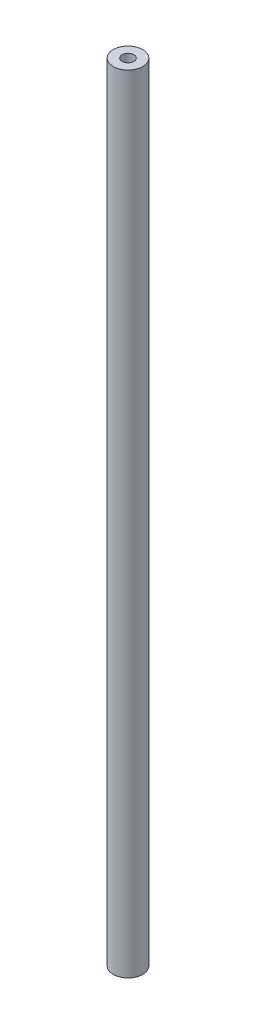
from build123d import *

# Parameters (mm, degrees)
SKETCH1_R                            = 4.7625
BOSS_EXTRUDE1_DEPTH                  = 254
F_10_24_TAPPED_HOLE1_D               = 3.7973
F_10_24_TAPPED_HOLE1_DEPTH           = 12.83
F_10_24_TAPPED_HOLE1_TIP             = 1.140824014
F_10_24_TAPPED_HOLE1_ON_FACE_2_D     = 3.7973
F_10_24_TAPPED_HOLE1_ON_FACE_2_DEPTH = 12.83
F_10_24_TAPPED_HOLE1_ON_FACE_2_TIP   = 1.140824014


with BuildPart() as part:
    # Sketch1 → Boss-Extrude1 (new body)
    with BuildSketch(Plane(origin=(0, 0, 0), x_dir=(1, 0, 0), z_dir=(0, 1, 0))):
        with Locations(Location((0, 0, 0), (0, 0, 270))):
            Circle(SKETCH1_R)
    extrude(amount=BOSS_EXTRUDE1_DEPTH)

    # #10-24 Tapped Hole1
    with Locations(Plane.ZX.offset(254)):
        with Locations((0, 0)):
            Hole(F_10_24_TAPPED_HOLE1_D / 2, depth=F_10_24_TAPPED_HOLE1_DEPTH)
            with Locations((0, 0, -(F_10_24_TAPPED_HOLE1_DEPTH + F_10_24_TAPPED_HOLE1_TIP / 2))):  # 118° drill point
                Cone(0, F_10_24_TAPPED_HOLE1_D / 2, F_10_24_TAPPED_HOLE1_TIP, mode=Mode.SUBTRACT)

    # #10-24 Tapped Hole1 on face 2
    with Locations(Plane(origin=(0, 0, 0), x_dir=(0, 0, -1), z_dir=(0, -1, 0))):
        with Locations((0, 0)):
            Hole(F_10_24_TAPPED_HOLE1_ON_FACE_2_D / 2, depth=F_10_24_TAPPED_HOLE1_ON_FACE_2_DEPTH)
            with Locations((0, 0, -(F_10_24_TAPPED_HOLE1_ON_FACE_2_DEPTH + F_10_24_TAPPED_HOLE1_ON_FACE_2_TIP / 2))):  # 118° drill point
                Cone(0, F_10_24_TAPPED_HOLE1_ON_FACE_2_D / 2, F_10_24_TAPPED_HOLE1_ON_FACE_2_TIP, mode=Mode.SUBTRACT)


solid = part.part
